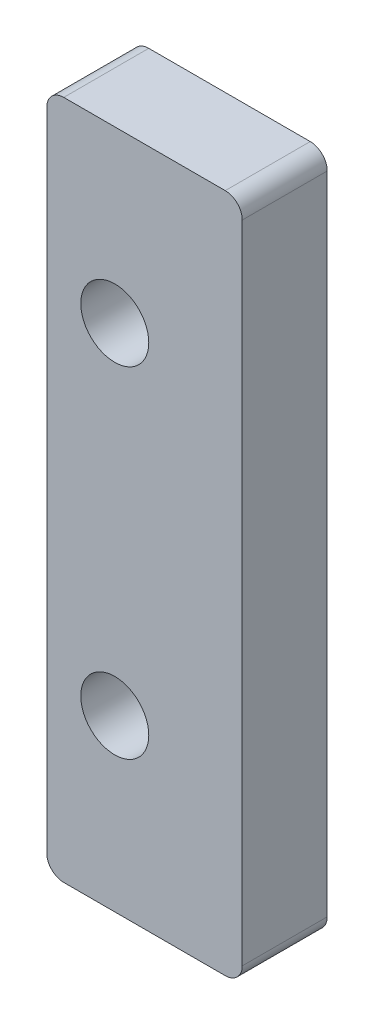
from build123d import *

# Parameters (mm, degrees)
SKETCH1_W           = 11.5
SKETCH1_H           = 40
SKETCH1_R           = 2
BOSS_EXTRUDE1_DEPTH = 5
FILLET1_R           = 1


with BuildPart() as part:
    # Sketch1 → Boss-Extrude1 (new body)
    with BuildSketch(Plane.XY):
        with Locations((5.75, 20)):
            Rectangle(SKETCH1_W, SKETCH1_H)
        with Locations((4, 10)):
            Circle(SKETCH1_R, mode=Mode.SUBTRACT)
        with Locations((4, 30)):
            Circle(SKETCH1_R, mode=Mode.SUBTRACT)
    extrude(amount=BOSS_EXTRUDE1_DEPTH)

    # Fillet1
    fillet1_edges = [part.edges().sort_by_distance(p)[0] for p in [
        (0, 40, 2.5),
        (11.5, 40, 2.5),
        (11.5, 0, 2.5),
        (0, 0, 2.5),
    ]]
    fillet(fillet1_edges, radius=FILLET1_R)


solid = part.part
